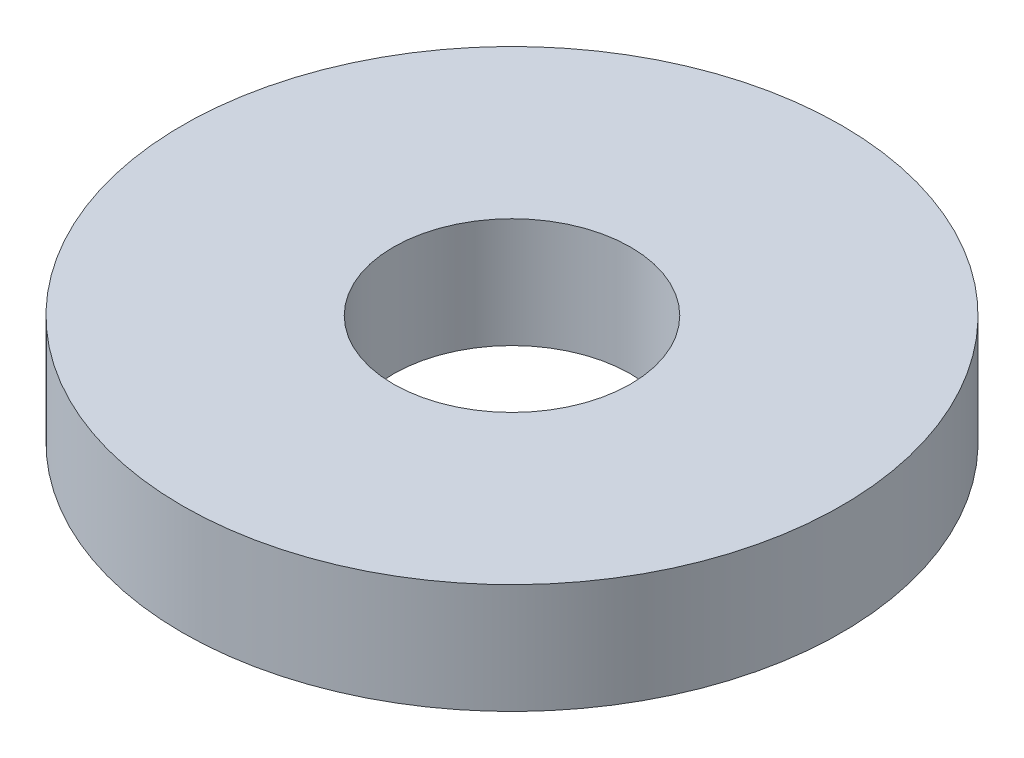
from build123d import *

# Parameters (mm, degrees)
SKETCH_1_R      = 7.5
SKETCH_1_R_2    = 2.7
EXTRUDE_1_DEPTH = 2.5


with BuildPart() as part:
    # 草圖1 → 填料-伸長1 (new body)
    with BuildSketch(Plane(origin=(0, 0, 0), x_dir=(1, 0, 0), z_dir=(0, 1, 0))):
        Circle(SKETCH_1_R)
        Circle(SKETCH_1_R_2, mode=Mode.SUBTRACT)
    extrude(amount=EXTRUDE_1_DEPTH)


solid = part.part
